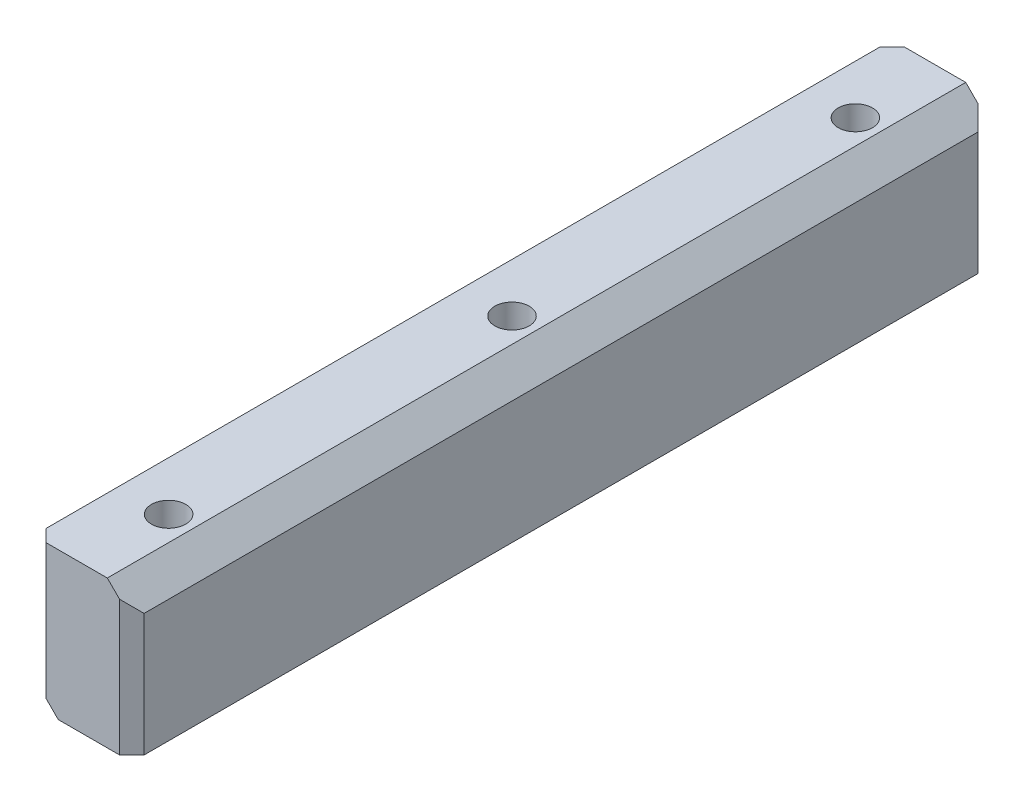
from build123d import *

# Parameters (mm, degrees)
SKETCH_1_W          = 40
SKETCH_1_H          = 60
EXTRUDE_1_DEPTH     = 350
CHAMFER_1_SIZE      = 10
HOLE_WIZARD_M16_1_D = 14
CHAMFER_2_SIZE      = 5


with BuildPart() as part:
    # 草图1 → 凸台-拉伸1 (new body)
    with BuildSketch(Plane.XY):
        with Locations((20, -30)):
            Rectangle(SKETCH_1_W, SKETCH_1_H)
    extrude(amount=EXTRUDE_1_DEPTH)

    # 倒角1
    chamfer_1_edges = [part.edges().sort_by_distance(p)[0] for p in [
        (40, 0, 175),
        (0, -60, 175),
    ]]
    chamfer(chamfer_1_edges, length=CHAMFER_1_SIZE)

    # M16 螺纹孔1 (through all)
    with Locations(Plane(origin=(0, 0, 0), x_dir=(1, 0, 0), z_dir=(0, 1, 0))):
        with Locations((20, -315), (20, -175), (20, -35)):
            Hole(HOLE_WIZARD_M16_1_D / 2)

    # 倒角2
    chamfer_2_edges = [part.edges().sort_by_distance(p)[0] for p in [
        (40, -35, 350),
        (0, -25, 350),
        (40, -35, 0),
        (0, -25, 0),
    ]]
    chamfer(chamfer_2_edges, length=CHAMFER_2_SIZE)


solid = part.part
